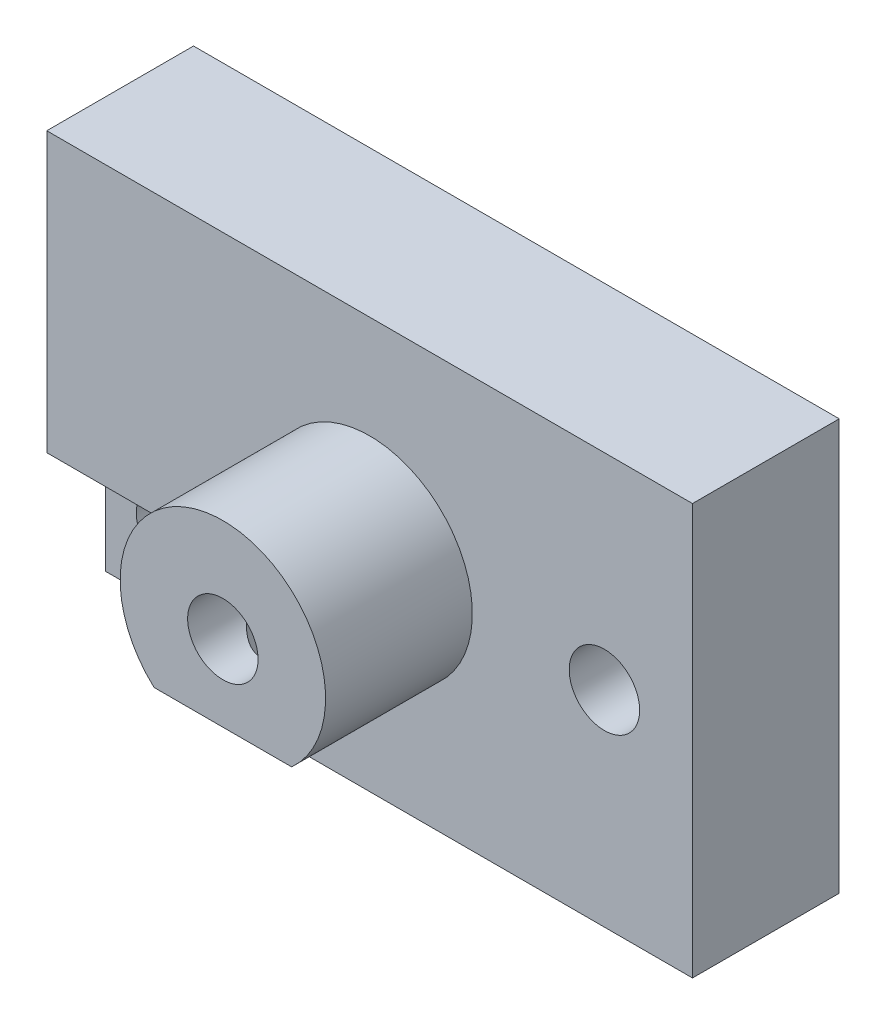
from build123d import *

# Parameters (mm, degrees)
SKETCH_1_W               = 110
SKETCH_1_H               = 70
EXTRUDE_1_DEPTH          = 25
SKETCH_2_R               = 17.5
EXTRUDE_2_DEPTH          = 25
SKETCH_3_R               = 6
CUT_EXTRUDE_1_DEPTH      = 83.158383626
SKETCH_5_W               = 45
SKETCH_5_H               = 45
CUT_EXTRUDE_3_DEPTH      = 10
SKETCH_6_R               = 6
CUT_EXTRUDE_4_DEPTH      = 74.993242935
SKETCH_7_R               = 6
CUT_EXTRUDE_5_DEPTH      = 70.821200219
CUT_EXTRUDE_START        = -25
CUT_EXTRUDE_6_DEPTH      = 25
CUT_EXTRUDE_7_REACH      = 90.482
CUT_EXTRUDE_7_END_RADIUS = 6
SKETCH_9_R               = 6


with BuildPart() as part:
    # Эскиз1 → Бобышка-Вытянуть1 (new body)
    with BuildSketch(Plane.XY):
        Rectangle(SKETCH_1_W, SKETCH_1_H)
    extrude(amount=EXTRUDE_1_DEPTH)

    # Эскиз2 → Бобышка-Вытянуть2 (add)
    with BuildSketch(Plane.XY.offset(25)):
        with Locations(Location((0, 0, 0), (0, 0, 180))):
            Circle(SKETCH_2_R)
    extrude(amount=EXTRUDE_2_DEPTH)

    # Эскиз3 → Вырез-Вытянуть1 (cut, through all)
    with BuildSketch(Plane.XY.offset(50)):
        Circle(SKETCH_3_R)
    extrude(amount=-CUT_EXTRUDE_1_DEPTH, mode=Mode.SUBTRACT)

    # Эскиз5 → Вырез-Вытянуть3 (cut)
    with BuildSketch(Plane.XY.offset(25)):
        with Locations((-55, -35)):
            Rectangle(SKETCH_5_W, SKETCH_5_H)
    extrude(amount=-CUT_EXTRUDE_3_DEPTH, mode=Mode.SUBTRACT)

    # Эскиз6 → Вырез-Вытянуть4 (cut, through all)
    with BuildSketch(Plane.XY.offset(15)):
        with Locations((-43.75, -23.75)):
            Circle(SKETCH_6_R)
    extrude(amount=-CUT_EXTRUDE_4_DEPTH, mode=Mode.SUBTRACT)

    # Эскиз7 → Вырез-Вытянуть5 (cut, through all)
    with BuildSketch(Plane.XY.offset(25)):
        with Locations((40, 0)):
            Circle(SKETCH_7_R)
    extrude(amount=-CUT_EXTRUDE_5_DEPTH, mode=Mode.SUBTRACT)

    # Эскиз8 → Вырез-Вытянуть6 (cut)
    with BuildSketch(Plane.XY.offset(50).offset(CUT_EXTRUDE_START)):
        with BuildLine():
            Line((-11.715374514, -13), (11.715374514, -13))
            ThreePointArc((11.715374514, -13), (0, -17.5), (-11.715374514, -13))
        make_face()
    extrude(amount=CUT_EXTRUDE_6_DEPTH, mode=Mode.SUBTRACT)

    # Вырез-Вытянуть7: up to this cylinder (the profile starts outside it)
    cut_extrude_7_end = Plane(origin=(0, 0, 37.5), z_dir=(0, 0, 1)) * Cylinder(CUT_EXTRUDE_7_END_RADIUS, 193.964, mode=Mode.PRIVATE)
    # Эскиз9 → Вырез-Вытянуть7 (cut, up to the surface)
    with BuildSketch(Plane.XZ.offset(13), mode=Mode.PRIVATE) as cut_extrude_7_sk1:
        with Locations(Location((0, 37.5, 0), (0, 0, 270))):
            Circle(SKETCH_9_R)
    cut_extrude_7_tool1 = extrude(cut_extrude_7_sk1.sketch, amount=-CUT_EXTRUDE_7_REACH, mode=Mode.PRIVATE) - cut_extrude_7_end
    add(cut_extrude_7_tool1.solids().sort_by_distance((0, -13, 37.5))[0], mode=Mode.SUBTRACT)


solid = part.part
